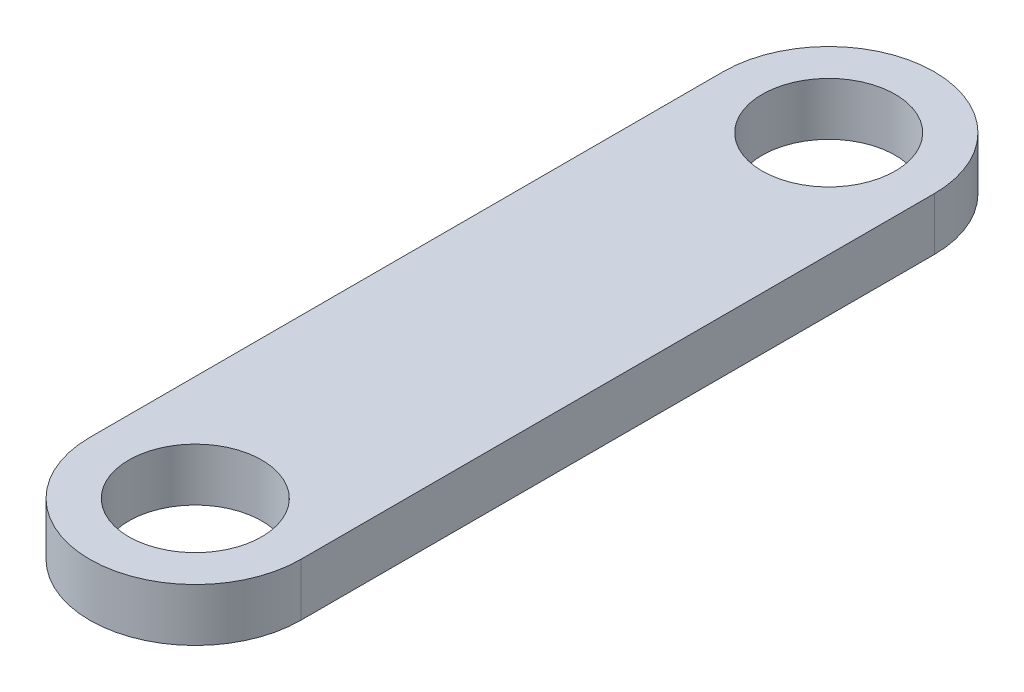
from build123d import *

# Parameters (mm, degrees)
SKETCH1_R           = 2
BOSS_EXTRUDE1_DEPTH = 1.5875


with BuildPart() as part:
    # Sketch1 → Boss-Extrude1 (new body)
    with BuildSketch(Plane(origin=(0, 0, 0), x_dir=(1, 0, 0), z_dir=(0, 1, 0))):
        with BuildLine():
            Line((3.175, -19.05), (3.175, 0))
            ThreePointArc((3.175, 0), (0, 3.175), (-3.175, 0))
            Line((-3.175, 0), (-3.175, -19.05))
            ThreePointArc((-3.175, -19.05), (0, -22.225), (3.175, -19.05))
        make_face()
        with Locations(Location((0, 0, 0), (0, 0, 270))):
            Circle(SKETCH1_R, mode=Mode.SUBTRACT)
        with Locations(Location((0, -19.05, 0), (0, 0, 270))):
            Circle(SKETCH1_R, mode=Mode.SUBTRACT)
    extrude(amount=-BOSS_EXTRUDE1_DEPTH)


solid = part.part
